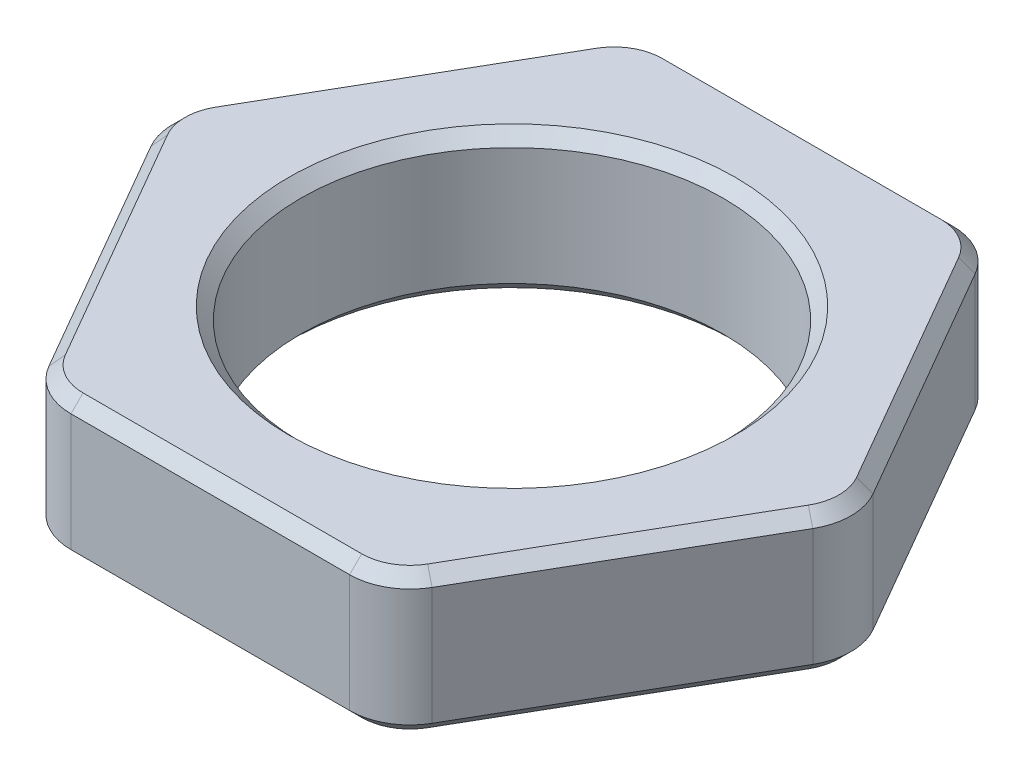
from build123d import *

# Parameters (mm, degrees)
SKETCH1_R           = 3.5
BOSS_EXTRUDE1_DEPTH = 1.175
FILLET1_R           = 1
CHAMFER1_SIZE       = 0.2


with BuildPart() as part:
    # Sketch1 → Boss-Extrude1 (new, symmetric)
    with BuildSketch(Plane(origin=(0, 0, 0), x_dir=(1, 0, 0), z_dir=(0, 1, 0))):
        Polygon((2.886751346, 5), (-2.886751346, 5), (-5.773502692, 0), (-2.886751346, -5), (2.886751346, -5), (5.773502692, 0), align=None)
        with Locations(Location((0, 0, 0), (0, 0, 270))):
            Circle(SKETCH1_R, mode=Mode.SUBTRACT)
    extrude(amount=BOSS_EXTRUDE1_DEPTH, both=True)

    # Fillet1
    fillet1_edges = [part.edges().sort_by_distance(p)[0] for p in [
        (5.773502692, 0, 0),
        (2.886751346, 0, 5),
        (-2.886751346, 0, 5),
        (-5.773502692, 0, 0),
        (-2.886751346, 0, -5),
        (2.886751346, 0, -5),
    ]]
    fillet(fillet1_edges, radius=FILLET1_R)

    # Chamfer1
    chamfer1_edges = [part.edges().sort_by_distance(p)[0] for p in [
        (0, -1.175, -3.5),
        (0, 1.175, -3.5),
        (4.330127019, -1.175, -2.5),
        (4.330127019, 1.175, -2.5),
        (4.330127019, -1.175, 2.5),
        (0, -1.175, 5),
        (-4.330127019, -1.175, 2.5),
        (-4.330127019, -1.175, -2.5),
        (0, -1.175, -5),
        (-2.809401077, -1.175, 4.866025404),
        (2.809401077, -1.175, -4.866025404),
        (-2.809401077, -1.175, -4.866025404),
        (-5.618802154, -1.175, 0),
        (2.809401077, -1.175, 4.866025404),
        (5.618802154, -1.175, 0),
        (4.330127019, 1.175, 2.5),
        (0, 1.175, -5),
        (-4.330127019, 1.175, -2.5),
        (-4.330127019, 1.175, 2.5),
        (0, 1.175, 5),
        (-2.809401077, 1.175, 4.866025404),
        (2.809401077, 1.175, -4.866025404),
        (-2.809401077, 1.175, -4.866025404),
        (-5.618802154, 1.175, 0),
        (2.809401077, 1.175, 4.866025404),
        (5.618802154, 1.175, 0),
    ]]
    chamfer(chamfer1_edges, length=CHAMFER1_SIZE)


solid = part.part
